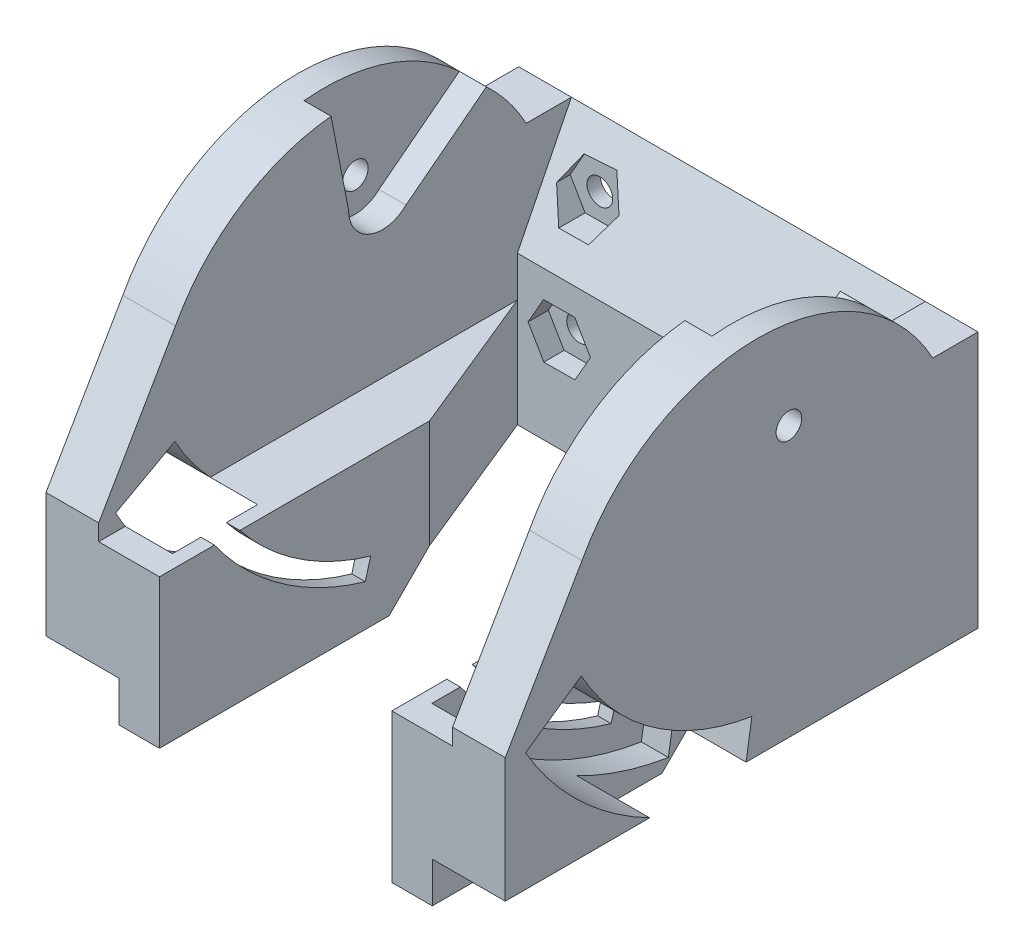
from build123d import *

# Parameters (mm, degrees)
CROQUIS1_W              = 34
CROQUIS1_H              = 19
SALIENTE_EXTRUIR1_DEPTH = 35
CROQUIS2_W              = 26.2
CROQUIS2_H              = 31
CORTAR_EXTRUIR1_DEPTH   = 25
CORTAR_EXTRUIR3_DEPTH   = 26.2
SALIENTE_EXTRUIR2_DEPTH = 34
CROQUIS10_W             = 26.2
CROQUIS10_H             = 25.966324345
CORTAR_EXTRUIR4_DEPTH   = 10
CROQUIS18_R             = 0.95
CORTAR_EXTRUIR11_DEPTH  = 4
CORTAR_EXTRUIR12_DEPTH  = 1.5
CORTAR_EXTRUIR13_DEPTH  = 3
CORTAR_EXTRUIR14_START  = -34
CROQUIS21_R             = 0.95
CORTAR_EXTRUIR14_DEPTH  = 34
SALIENTE_EXTRUIR3_DEPTH = 8
CORTAR_EXTRUIR16_START  = -34
CORTAR_EXTRUIR16_DEPTH  = 34
CROQUIS25_W             = 3
CROQUIS25_H             = 20
SALIENTE_EXTRUIR4_DEPTH = 3
CORTAR_EXTRUIR17_START  = -23.2
CORTAR_EXTRUIR17_DEPTH  = 23.2
CORTAR_EXTRUIR18_DEPTH  = 7.4
CORTAR_EXTRUIR19_START  = -7.4
CORTAR_EXTRUIR19_DEPTH  = 7.4
CORTAR_EXTRUIR20_START  = -2
CORTAR_EXTRUIR20_DEPTH  = 2
CORTAR_EXTRUIR21_DEPTH  = 28.2
CORTAR_EXTRUIR22_START  = -34
CORTAR_EXTRUIR22_DEPTH  = 34


with BuildPart() as part:
    # Croquis1 → Saliente-Extruir1 (new body)
    with BuildSketch(Plane.XY):
        with Locations((-31.887263086, 5.12254902)):
            Rectangle(CROQUIS1_W, CROQUIS1_H)
    extrude(amount=SALIENTE_EXTRUIR1_DEPTH)

    # Croquis2 → Cortar-Extruir1 (cut)
    with BuildSketch(Plane.XZ.offset(4.37745098)):
        with Locations((-31.887263086, 19.5)):
            Rectangle(CROQUIS2_W, CROQUIS2_H)
    extrude(amount=-CORTAR_EXTRUIR1_DEPTH, mode=Mode.SUBTRACT)

    # Croquis4 → Cortar-Extruir3 (cut)
    with BuildSketch(Plane.ZY.offset(18.787263086)):
        Polygon((4, 14.62254902), (4, 6.62254902), (0, 14.62254902), align=None)
    extrude(amount=CORTAR_EXTRUIR3_DEPTH, mode=Mode.SUBTRACT)

    # Croquis9 → Saliente-Extruir2 (add)
    with BuildSketch(Plane(origin=(-14.887263086, 0, 0), x_dir=(0, 0, -1), z_dir=(1, 0, 0))):
        with BuildLine():
            Line((-29.315831827, 14.62254902), (-3.349507482, 14.62254902))
            ThreePointArc((-3.349507482, 14.62254902), (-16.332669655, 22.37254902), (-29.315831827, 14.62254902))
        make_face()
    extrude(amount=-SALIENTE_EXTRUIR2_DEPTH)

    # Croquis10 → Cortar-Extruir4 (cut)
    with BuildSketch(Plane.XZ.offset(-14.62254902)):
        with Locations((-31.887263086, 16.332669655)):
            Rectangle(CROQUIS10_W, CROQUIS10_H)
    extrude(amount=-CORTAR_EXTRUIR4_DEPTH, mode=Mode.SUBTRACT)

    # Croquis18 → Cortar-Extruir11 (cut)
    with BuildSketch(Plane(origin=(0, 0, 0), x_dir=(-1, 0, 0), z_dir=(0, 0, -1))):
        with Locations((41.887263086, 2.62254902)):
            Circle(CROQUIS18_R)
        with Locations((21.887263086, 2.62254902)):
            Circle(CROQUIS18_R)
        with Locations((21.887263086, 10.62254902)):
            Circle(CROQUIS18_R)
        with Locations((41.887263086, 10.62254902)):
            Circle(CROQUIS18_R)
    extrude(amount=-CORTAR_EXTRUIR11_DEPTH, mode=Mode.SUBTRACT)

    # Croquis19 → Cortar-Extruir12 (cut)
    with BuildSketch(Plane.XY.offset(4)):
        Polygon((-43.030772734, 0.616129568), (-40.721407694, 0.629030888), (-39.577898045, 2.63545034), (-40.743753437, 4.628968471), (-43.053118477, 4.616067151), (-44.196628126, 2.609647699), align=None)
        Polygon((-23.030772734, 0.616129568), (-20.721407694, 0.629030888), (-19.577898045, 2.63545034), (-20.743753437, 4.628968471), (-23.053118477, 4.616067151), (-24.196628126, 2.609647699), align=None)
    extrude(amount=-CORTAR_EXTRUIR12_DEPTH, mode=Mode.SUBTRACT)

    # Croquis20 → Cortar-Extruir13 (cut)
    with BuildSketch(Plane.XY.offset(4)):
        Polygon((-44.081159874, 10.610292765), (-42.973597252, 8.71645054), (-40.779700463, 8.728706795), (-39.520722563, 10.735771313), (-40.628285185, 12.629613538), (-42.994825708, 12.516391244), align=None)
        Polygon((-24.081159874, 10.610292765), (-22.973597252, 8.71645054), (-20.779700463, 8.728706795), (-19.520722563, 10.735771313), (-20.628285185, 12.629613538), (-22.994825708, 12.516391244), align=None)
    extrude(amount=-CORTAR_EXTRUIR13_DEPTH, mode=Mode.SUBTRACT)

    # Croquis21 → Cortar-Extruir14 (cut)
    with BuildSketch(Plane(origin=(-14.887263086, 0, 0), x_dir=(0, 0, -1), z_dir=(1, 0, 0)).offset(CORTAR_EXTRUIR14_START)):
        with Locations((-14, 15.62254902)):
            Circle(CROQUIS21_R)
    extrude(amount=CORTAR_EXTRUIR14_DEPTH, mode=Mode.SUBTRACT)

    # Croquis23 → Saliente-Extruir3 (add)
    with BuildSketch(Plane.XZ.offset(4.37745098)):
        Polygon((-44.987263086, 35), (-40.487263086, 35), (-40.487263086, 15), (-44.987263086, 4), align=None)
        Polygon((-18.787263086, 35), (-23.287263086, 35), (-23.287263086, 15), (-18.787263086, 4), align=None)
    extrude(amount=-SALIENTE_EXTRUIR3_DEPTH)

    # Croquis24 → Cortar-Extruir16 (cut)
    with BuildSketch(Plane(origin=(-14.887263086, 0, 0), x_dir=(0, 0, -1), z_dir=(1, 0, 0)).offset(CORTAR_EXTRUIR16_START)):
        with BuildLine():
            Line((-19.364815558, -2.86477783), (-19.759303848, -4.311974772))
            ThreePointArc((-19.759303848, -4.311974772), (-26.555897405, -0.897265142), (-31.665347016, 4.737222456))
            Line((-31.665347016, 4.737222456), (-30.432986509, 5.596609942))
            ThreePointArc((-30.432986509, 5.596609942), (-25.6912281, 0.329488976), (-19.364815558, -2.86477783))
        make_face()
    extrude(amount=CORTAR_EXTRUIR16_DEPTH, mode=Mode.SUBTRACT)

    # Croquis25 → Saliente-Extruir4 (add)
    with BuildSketch(Plane.XZ.offset(4.37745098)):
        with Locations((-21.787263086, 25)):
            Rectangle(CROQUIS25_W, CROQUIS25_H)
        with Locations((-41.987263086, 25)):
            Rectangle(CROQUIS25_W, CROQUIS25_H)
    extrude(amount=SALIENTE_EXTRUIR4_DEPTH)

    # Croquis26 → Cortar-Extruir17 (cut)
    with BuildSketch(Plane(origin=(-20.287263086, 0, 0), x_dir=(0, 0, -1), z_dir=(1, 0, 0)).offset(CORTAR_EXTRUIR17_START)):
        Polygon((-18, -7.37745098), (-15, -7.37745098), (-15, -4.37745098), align=None)
    extrude(amount=CORTAR_EXTRUIR17_DEPTH, mode=Mode.SUBTRACT)

    # Croquis27 → Cortar-Extruir18 (cut)
    with BuildSketch(Plane(origin=(-14.887263086, 0, 0), x_dir=(0, 0, -1), z_dir=(1, 0, 0))):
        with BuildLine():
            Line((-16.740334426, -1.661564126), (-17.523287119, -6.599882168))
            ThreePointArc((-17.523287119, -6.599882168), (-26.750931424, -2.915621004), (-33.492032026, 4.383746258))
            Line((-33.492032026, 4.383746258), (-29.371216121, 7.25740019))
            ThreePointArc((-29.371216121, 7.25740019), (-24.094258117, 1.327236743), (-16.740334426, -1.661564126))
        make_face()
    extrude(amount=-CORTAR_EXTRUIR18_DEPTH, mode=Mode.SUBTRACT)

    # Croquis28 → Cortar-Extruir19 (cut)
    with BuildSketch(Plane.ZY.offset(48.887263086).offset(CORTAR_EXTRUIR19_START)):
        with BuildLine():
            Line((29.35443361, 7.226635221), (33.741414641, 4.827802707))
            ThreePointArc((33.741414641, 4.827802707), (26.967501757, -2.764780808), (17.541604251, -6.596970312))
            Line((17.541604251, -6.596970312), (16.754581084, -1.659299349))
            ThreePointArc((16.754581084, -1.659299349), (24.0858347, 1.321292487), (29.35443361, 7.226635221))
        make_face()
    extrude(amount=CORTAR_EXTRUIR19_DEPTH, mode=Mode.SUBTRACT)

    # Croquis29 → Cortar-Extruir20 (cut)
    with BuildSketch(Plane.ZY.offset(18.787263086).offset(CORTAR_EXTRUIR20_START)):
        with BuildLine():
            Line((17.797402962, 22.299641931), (16.5, 15.62254902))
            ThreePointArc((16.5, 15.62254902), (14.970464446, 13.318596164), (12.253440993, 13.833825555))
            Line((12.253440993, 13.833825555), (6.296886003, 18.432060872))
            ThreePointArc((6.296886003, 18.432060872), (11.631045274, 21.603150873), (17.797402962, 22.299641931))
        make_face()
    extrude(amount=CORTAR_EXTRUIR20_DEPTH, mode=Mode.SUBTRACT)

    # Croquis29<2> → Cortar-Extruir21 (cut)
    with BuildSketch(Plane.ZY.offset(18.787263086)):
        with BuildLine():
            Line((17.797402962, 22.299641931), (16.5, 15.62254902))
            ThreePointArc((16.5, 15.62254902), (14.970464446, 13.318596164), (12.253440993, 13.833825555))
            Line((12.253440993, 13.833825555), (6.296886003, 18.432060872))
            ThreePointArc((6.296886003, 18.432060872), (11.631045274, 21.603150873), (17.797402962, 22.299641931))
        make_face()
    extrude(amount=CORTAR_EXTRUIR21_DEPTH, mode=Mode.SUBTRACT)

    # Croquis30 → Cortar-Extruir22 (cut)
    with BuildSketch(Plane.ZY.offset(48.887263086).offset(CORTAR_EXTRUIR22_START)):
        Polygon((29.315831827, 14.62254902), (35, 4.827802707), (35, 14.62254902), align=None)
    extrude(amount=CORTAR_EXTRUIR22_DEPTH, mode=Mode.SUBTRACT)


solid = part.part
